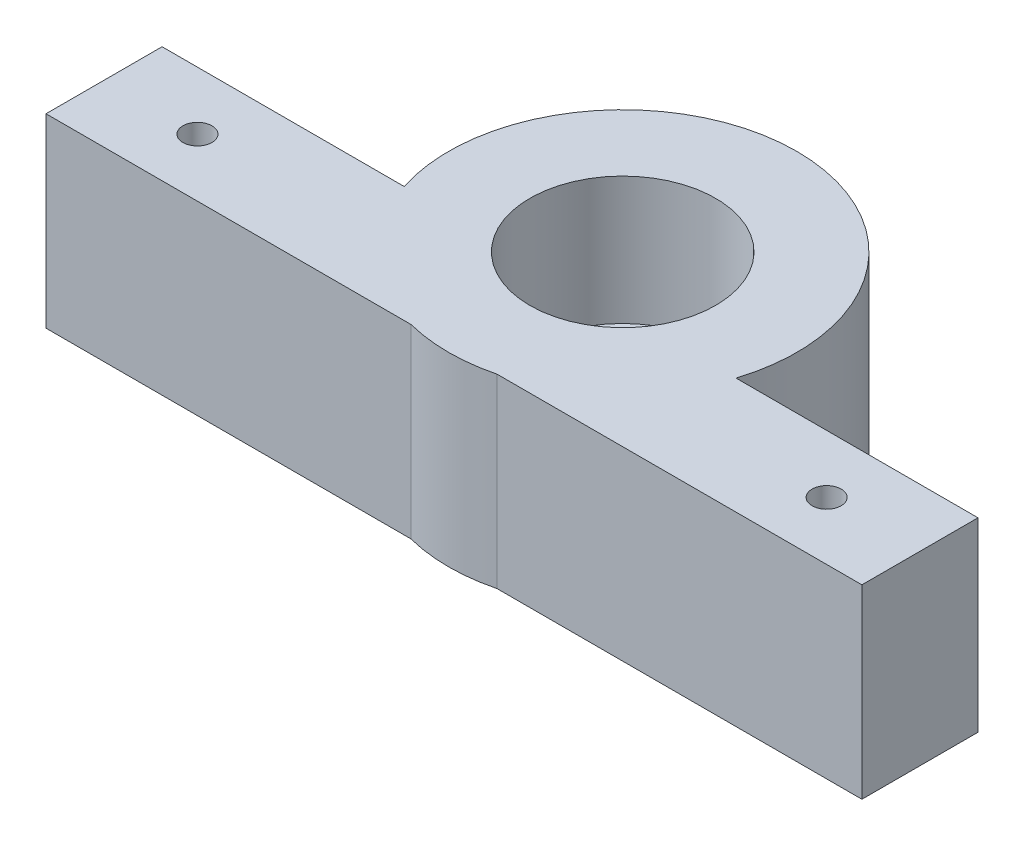
from build123d import *

# Parameters (mm, degrees)
SKETCH1_R           = 1.875
SKETCH1_R_2         = 0.625
BOSS_EXTRUDE1_DEPTH = 8
SKETCH2_R           = 4
CUT_EXTRUDE1_DEPTH  = 5.5


with BuildPart() as part:
    # Sketch1 → Boss-Extrude1 (new body)
    with BuildSketch(Plane(origin=(0, 0, 0), x_dir=(1, 0, 0), z_dir=(0, 1, 0))):
        with BuildLine():
            Line((-7.148944203, -2.267729434), (-17.572518578, -2.267729434))
            Line((-17.572518578, -2.267729434), (-17.572518578, -7.267729434))
            Line((-17.572518578, -7.267729434), (-1.852055311, -7.267729434))
            ThreePointArc((-1.852055311, -7.267729434), (0, -7.5), (1.852055311, -7.267729434))
            Line((1.852055311, -7.267729434), (17.569617046, -7.267729434))
            Line((17.569617046, -7.267729434), (17.569617046, -2.267729434))
            Line((17.569617046, -2.267729434), (7.148944203, -2.267729434))
            ThreePointArc((7.148944203, -2.267729434), (0, 7.5), (-7.148944203, -2.267729434))
        make_face()
        with Locations(Location((0, 0, 0), (0, 0, 270))):
            Circle(SKETCH1_R, mode=Mode.SUBTRACT)
        with Locations(Location((-13.55, -4.767729434, 0), (0, 0, 270))):
            Circle(SKETCH1_R_2, mode=Mode.SUBTRACT)
        with Locations(Location((13.55, -4.767729434, 0), (0, 0, 270))):
            Circle(SKETCH1_R_2, mode=Mode.SUBTRACT)
    extrude(amount=BOSS_EXTRUDE1_DEPTH)

    # Sketch2 → Cut-Extrude1 (cut)
    with BuildSketch(Plane(origin=(0, 8, 0), x_dir=(1, 0, 0), z_dir=(0, 1, 0))):
        with Locations(Location((0, 0, 0), (0, 0, 270))):
            Circle(SKETCH2_R)
    extrude(amount=-CUT_EXTRUDE1_DEPTH, mode=Mode.SUBTRACT)


solid = part.part
